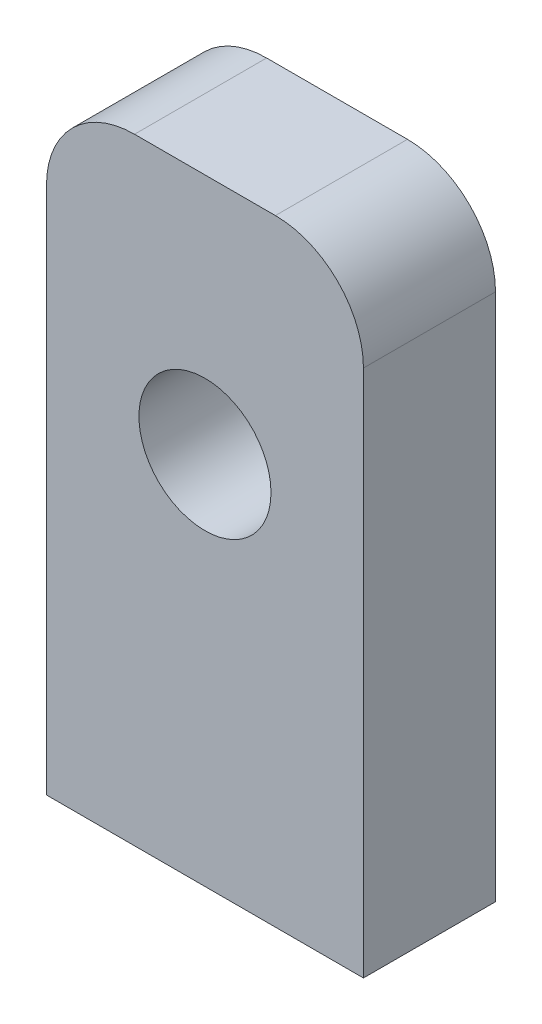
from build123d import *

# Parameters (mm, degrees)
ESBO_O1_W                = 7.2
ESBO_O1_H                = 14
ESBO_O1_R                = 1.5
RESSALTO_EXTRUS_O1_DEPTH = 3
FILETE1_R                = 2


with BuildPart() as part:
    # Esboço1 → Ressalto-extrusão1 (new body)
    with BuildSketch(Plane.XY):
        with Locations((3.6, 7)):
            Rectangle(ESBO_O1_W, ESBO_O1_H)
        with Locations((3.6, 8.5)):
            Circle(ESBO_O1_R, mode=Mode.SUBTRACT)
    extrude(amount=RESSALTO_EXTRUS_O1_DEPTH)

    # Filete1
    filete1_edges = [part.edges().sort_by_distance(p)[0] for p in [
        (0, 14, 1.5),
        (7.2, 14, 1.5),
    ]]
    fillet(filete1_edges, radius=FILETE1_R)


solid = part.part
